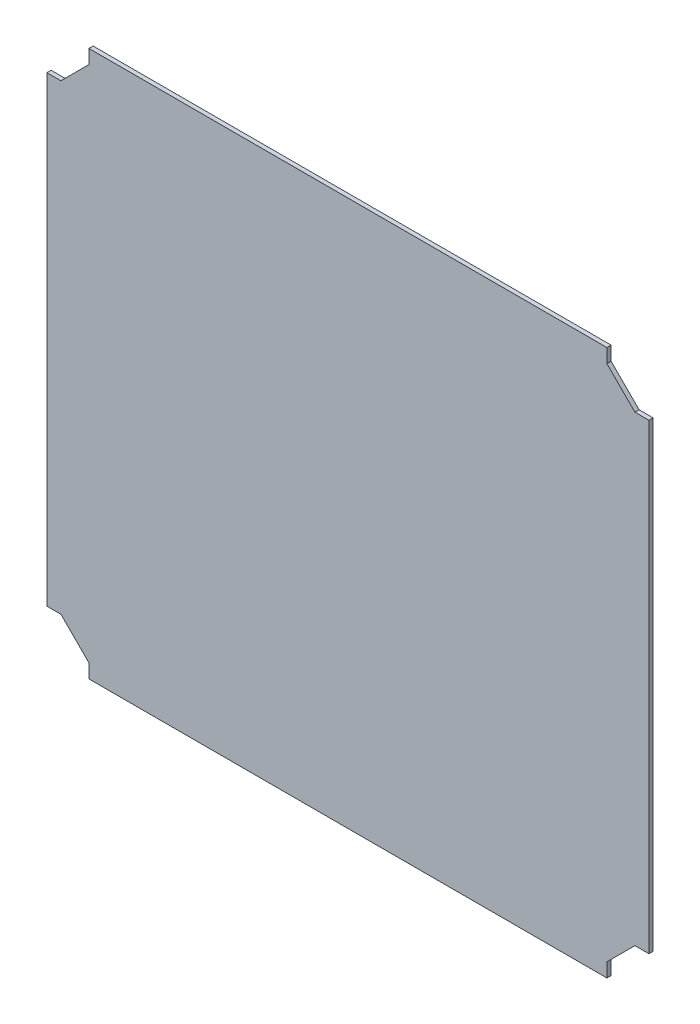
from build123d import *

# Parameters (mm, degrees)
SKETCH1_W           = 860
SKETCH1_H           = 780
BOSS_EXTRUDE1_DEPTH = 6
SKETCH2_W           = 60
SKETCH2_H           = 60
CUT_EXTRUDE1_DEPTH  = 6
CHAMFER1_SIZE       = 40


with BuildPart() as part:
    # Sketch1 → Boss-Extrude1 (new body)
    with BuildSketch(Plane.XY):
        Rectangle(SKETCH1_W, SKETCH1_H)
    extrude(amount=BOSS_EXTRUDE1_DEPTH)

    # Sketch2 → Cut-Extrude1 (cut)
    with BuildSketch(Plane.XY.offset(6)):
        with Locations((-400, 360)):
            Rectangle(SKETCH2_W, SKETCH2_H)
        with Locations((400, 360)):
            Rectangle(SKETCH2_W, SKETCH2_H)
        with Locations((400, -360)):
            Rectangle(SKETCH2_W, SKETCH2_H)
        with Locations((-400, -360)):
            Rectangle(SKETCH2_W, SKETCH2_H)
    extrude(amount=-CUT_EXTRUDE1_DEPTH, mode=Mode.SUBTRACT)

    # Chamfer1
    chamfer1_edges = [part.edges().sort_by_distance(p)[0] for p in [
        (-370, -330, 3),
        (370, -330, 3),
        (370, 330, 3),
        (-370, 330, 3),
    ]]
    chamfer(chamfer1_edges, length=CHAMFER1_SIZE)


solid = part.part
